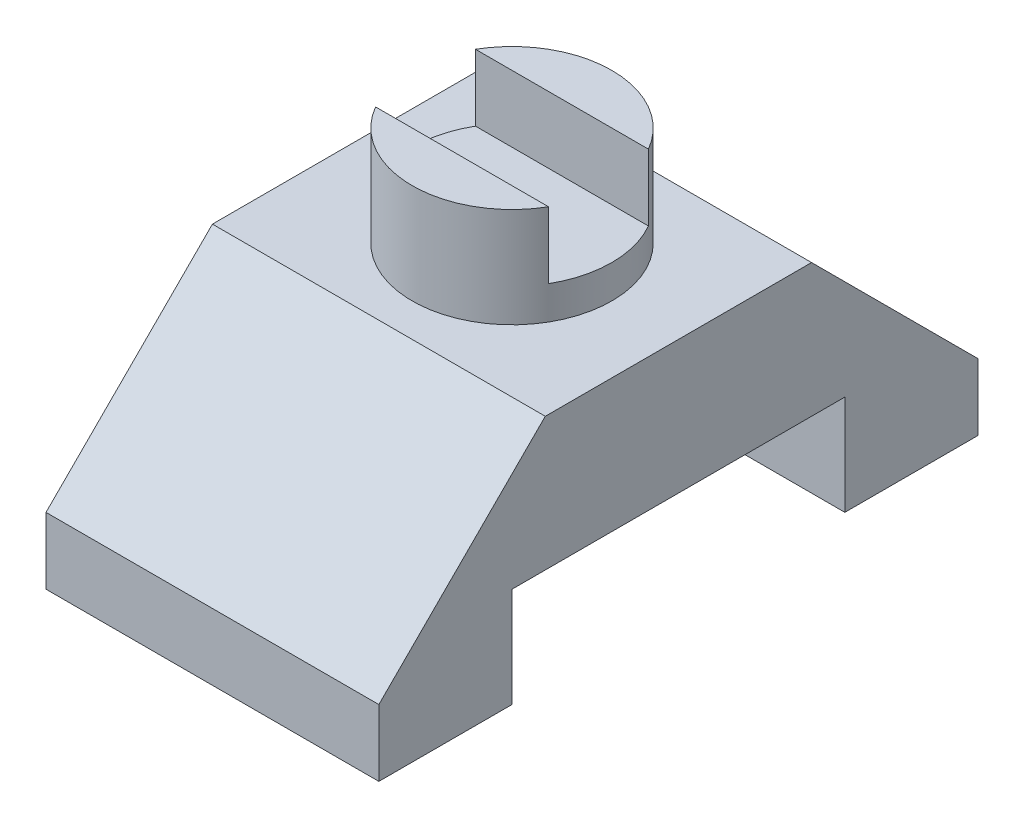
from build123d import *

# Parameters (mm, degrees)
SALIENTE_EXTRUIR1_DEPTH                = 25
CORTAR_EXTRUIR1_REACH                  = 73.764
CORTAR_EXTRUIR1_END_RADIUS             = 15
CROQUIS5_W                             = 15
CROQUIS5_H                             = 10
CORTAR_EXTRUIR1_DIRECTION_2_REACH      = 73.764
CORTAR_EXTRUIR1_DIRECTION_2_END_RADIUS = 15


with BuildPart() as part:
    # Croquis2 → Saliente-Extruir1 (new, symmetric)
    with BuildSketch(Plane(origin=(0, 0, 0), x_dir=(0, 0, -1), z_dir=(1, 0, 0))):
        Polygon((-45, 0), (-25, 0), (-25, 15), (25, 15), (25, 0), (45, 0), (45, 10), (20, 35), (-20, 35), (-45, 10), align=None)
    extrude(amount=SALIENTE_EXTRUIR1_DEPTH, both=True)

    # Croquis3 → Revolución2 (revolve)
    with BuildSketch(Plane(origin=(0, 0, 0), x_dir=(0, 0, -1), z_dir=(1, 0, 0))):
        Polygon((0, 35), (15, 35), (15, 50), (7.5, 50), (7.5, 40), (0, 40), align=None)
    revolve(axis=Axis((0, -6.406995379, 0), (0, 1, 0)))

    # Cortar-Extruir1: up to this cylinder (the profile starts inside it)
    cortar_extruir1_end = Plane(origin=(0, 45, 0), z_dir=(0, -1, 0)) * Cylinder(CORTAR_EXTRUIR1_END_RADIUS, 178.528, mode=Mode.PRIVATE)
    # Croquis5 → Cortar-Extruir1 (cut, up to the surface)
    with BuildSketch(Plane(origin=(0, 0, 0), x_dir=(0, 0, -1), z_dir=(1, 0, 0)), mode=Mode.PRIVATE) as cortar_extruir1_sk1:
        with Locations((0, 45)):
            Rectangle(CROQUIS5_W, CROQUIS5_H)
    cortar_extruir1_tool1 = extrude(cortar_extruir1_sk1.sketch, amount=-CORTAR_EXTRUIR1_REACH, mode=Mode.PRIVATE) & cortar_extruir1_end
    add(cortar_extruir1_tool1.solids().sort_by_distance((0, 45, 0))[0], mode=Mode.SUBTRACT)

    # Cortar-Extruir1 direction 2: up to this cylinder (the profile starts inside it)
    cortar_extruir1_direction_2_end = Plane(origin=(0, 45, 0), z_dir=(0, -1, 0)) * Cylinder(CORTAR_EXTRUIR1_DIRECTION_2_END_RADIUS, 178.528, mode=Mode.PRIVATE)
    # Croquis5 → Cortar-Extruir1 direction 2 (cut, up to the surface)
    with BuildSketch(Plane(origin=(0, 0, 0), x_dir=(0, 0, -1), z_dir=(1, 0, 0)), mode=Mode.PRIVATE) as cortar_extruir1_direction_2_sk1:
        with Locations((0, 45)):
            Rectangle(CROQUIS5_W, CROQUIS5_H)
    cortar_extruir1_direction_2_tool1 = extrude(cortar_extruir1_direction_2_sk1.sketch, amount=CORTAR_EXTRUIR1_DIRECTION_2_REACH, mode=Mode.PRIVATE) & cortar_extruir1_direction_2_end
    add(cortar_extruir1_direction_2_tool1.solids().sort_by_distance((0, 45, 0))[0], mode=Mode.SUBTRACT)


solid = part.part
